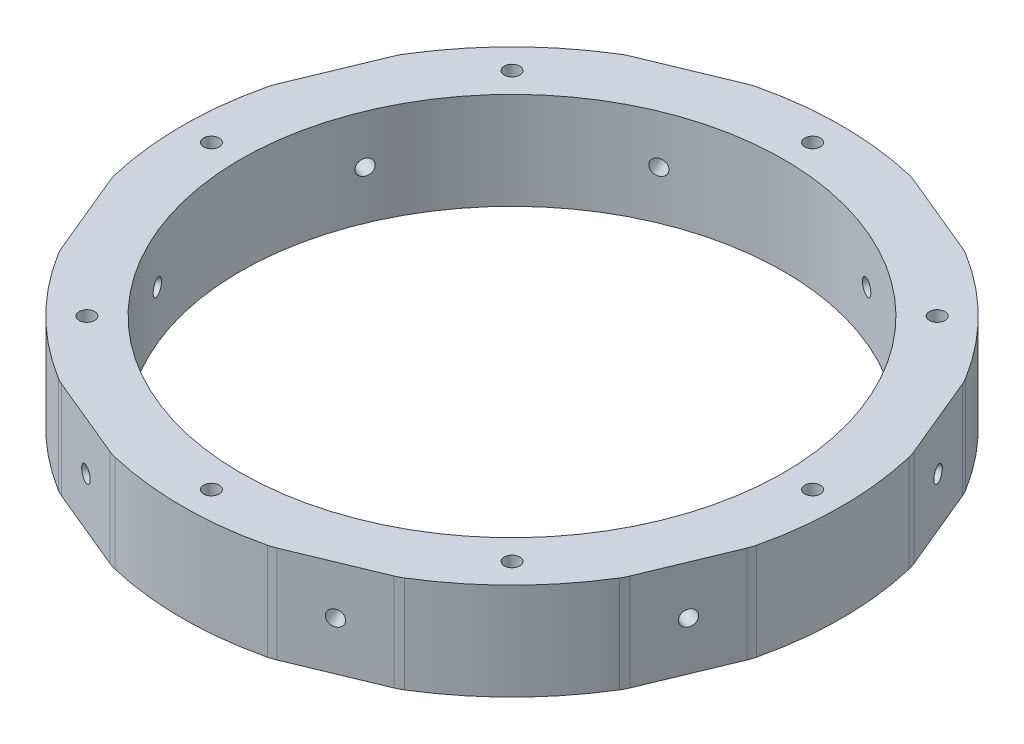
from build123d import *

# Parameters (mm, degrees)
SKETCH1_R               = 68
SKETCH1_R_2             = 56
SKETCH1_R_3             = 1.6
BOSS_EXTRUDE1_DEPTH     = 20
SKETCH2_R               = 76
CUT_EXTRUDE1_DEPTH      = 99.224233262
CUT_EXTRUDE2_REACH      = 163.628
CUT_EXTRUDE2_END_RADIUS = 56
SKETCH3_R               = 1.6
CIRPATTERN4_COUNT       = 8
FILLET1_R               = 10


with BuildPart() as part:
    # Sketch1 → Boss-Extrude1 (new body)
    with BuildSketch(Plane(origin=(0, 0, 0), x_dir=(1, 0, 0), z_dir=(0, 1, 0))):
        with Locations(Location((0, 0, 0), (0, 0, 270))):
            Circle(SKETCH1_R)
        with Locations(Location((0, 0, 0), (0, 0, 270))):
            Circle(SKETCH1_R_2, mode=Mode.SUBTRACT)
        with Locations(Location((0, 62, 0), (0, 0, 270))):
            Circle(SKETCH1_R_3, mode=Mode.SUBTRACT)
        with Locations(Location((43.840620434, 43.840620434, 0), (0, 0, 270))):
            Circle(SKETCH1_R_3, mode=Mode.SUBTRACT)
        with Locations(Location((62, 0, 0), (0, 0, 270))):
            Circle(SKETCH1_R_3, mode=Mode.SUBTRACT)
        with Locations(Location((43.840620434, -43.840620434, 0), (0, 0, 270))):
            Circle(SKETCH1_R_3, mode=Mode.SUBTRACT)
        with Locations(Location((0, -62, 0), (0, 0, 270))):
            Circle(SKETCH1_R_3, mode=Mode.SUBTRACT)
        with Locations(Location((-43.840620434, -43.840620434, 0), (0, 0, 270))):
            Circle(SKETCH1_R_3, mode=Mode.SUBTRACT)
        with Locations(Location((-62, 0, 0), (0, 0, 270))):
            Circle(SKETCH1_R_3, mode=Mode.SUBTRACT)
        with Locations(Location((-43.840620434, 43.840620434, 0), (0, 0, 270))):
            Circle(SKETCH1_R_3, mode=Mode.SUBTRACT)
    extrude(amount=BOSS_EXTRUDE1_DEPTH)

    # Sketch2 → Cut-Extrude1 (cut, through all)
    with BuildSketch(Plane(origin=(0, 20, 0), x_dir=(1, 0, 0), z_dir=(0, 1, 0))):
        Circle(SKETCH2_R)
        with BuildLine():
            Line((16.500755195, 65.967606278), (34.978345845, 58.31393763))
            ThreePointArc((34.978345845, 58.31393763), (48.083261121, 48.083261121), (58.31393763, 34.978345845))
            Line((58.31393763, 34.978345845), (65.967606278, 16.500755195))
            ThreePointArc((65.967606278, 16.500755195), (68, 0), (65.967606278, -16.500755195))
            Line((65.967606278, -16.500755195), (58.31393763, -34.978345845))
            ThreePointArc((58.31393763, -34.978345845), (48.083261121, -48.083261121), (34.978345845, -58.31393763))
            Line((34.978345845, -58.31393763), (16.500755195, -65.967606278))
            ThreePointArc((16.500755195, -65.967606278), (0, -68), (-16.500755195, -65.967606278))
            Line((-16.500755195, -65.967606278), (-34.978345845, -58.31393763))
            ThreePointArc((-34.978345845, -58.31393763), (-48.083261121, -48.083261121), (-58.31393763, -34.978345845))
            Line((-58.31393763, -34.978345845), (-65.967606278, -16.500755195))
            ThreePointArc((-65.967606278, -16.500755195), (-68, 0), (-65.967606278, 16.500755195))
            Line((-65.967606278, 16.500755195), (-58.31393763, 34.978345845))
            ThreePointArc((-58.31393763, 34.978345845), (-48.083261121, 48.083261121), (-34.978345845, 58.31393763))
            Line((-34.978345845, 58.31393763), (-16.500755195, 65.967606278))
            ThreePointArc((-16.500755195, 65.967606278), (0, 68), (16.500755195, 65.967606278))
        make_face(mode=Mode.SUBTRACT)
    extrude(amount=-CUT_EXTRUDE1_DEPTH, mode=Mode.SUBTRACT)

    # Cut-Extrude2: up to this cylinder (the profile starts outside it)
    cut_extrude2_end = Plane(origin=(0, 10, 0), z_dir=(0, -1, 0)) * Cylinder(CUT_EXTRUDE2_END_RADIUS, 440.256, mode=Mode.PRIVATE)
    # Sketch3 → Cut-Extrude2 (cut, up to the surface)
    with BuildSketch(Plane(origin=(-25.73955052, 0, -62.140771954), x_dir=(-0.9238795325112866, 0, 0.38268343236509017), z_dir=(-0.3826834323650902, 0, -0.9238795325112867)), mode=Mode.PRIVATE) as cut_extrude2_sk1:
        with Locations((0, 10)):
            Circle(SKETCH3_R)
    cut_extrude2_tool1 = extrude(cut_extrude2_sk1.sketch, amount=-CUT_EXTRUDE2_REACH, mode=Mode.PRIVATE) - cut_extrude2_end
    cut_extrude2 = cut_extrude2_tool1.solids().sort_by_distance((-25.739551, 10, -62.140772))[0]
    add(cut_extrude2, mode=Mode.SUBTRACT)

    # CirPattern4: Cut-Extrude2 ×8 about axis
    cirpattern4_axis = Axis((0, 20, 0), (0, 1, 0))
    for i in range(1, CIRPATTERN4_COUNT):
        add(cut_extrude2.rotate(cirpattern4_axis, i * 360 / CIRPATTERN4_COUNT), mode=Mode.SUBTRACT)

    # Fillet1
    fillet1_edges = [part.edges().sort_by_distance(p)[0] for p in [
        (16.500755195, 10, -65.967606278),
        (34.978345845, 10, -58.31393763),
        (58.31393763, 10, -34.978345845),
        (65.967606278, 10, -16.500755195),
        (65.967606278, 10, 16.500755195),
        (58.31393763, 10, 34.978345845),
        (34.978345845, 10, 58.31393763),
        (16.500755195, 10, 65.967606278),
        (-16.500755195, 10, 65.967606278),
        (-34.978345845, 10, 58.31393763),
        (-58.31393763, 10, 34.978345845),
        (-65.967606278, 10, 16.500755195),
        (-65.967606278, 10, -16.500755195),
        (-58.31393763, 10, -34.978345845),
        (-34.978345845, 10, -58.31393763),
        (-16.500755195, 10, -65.967606278),
    ]]
    fillet(fillet1_edges, radius=FILLET1_R)


solid = part.part
